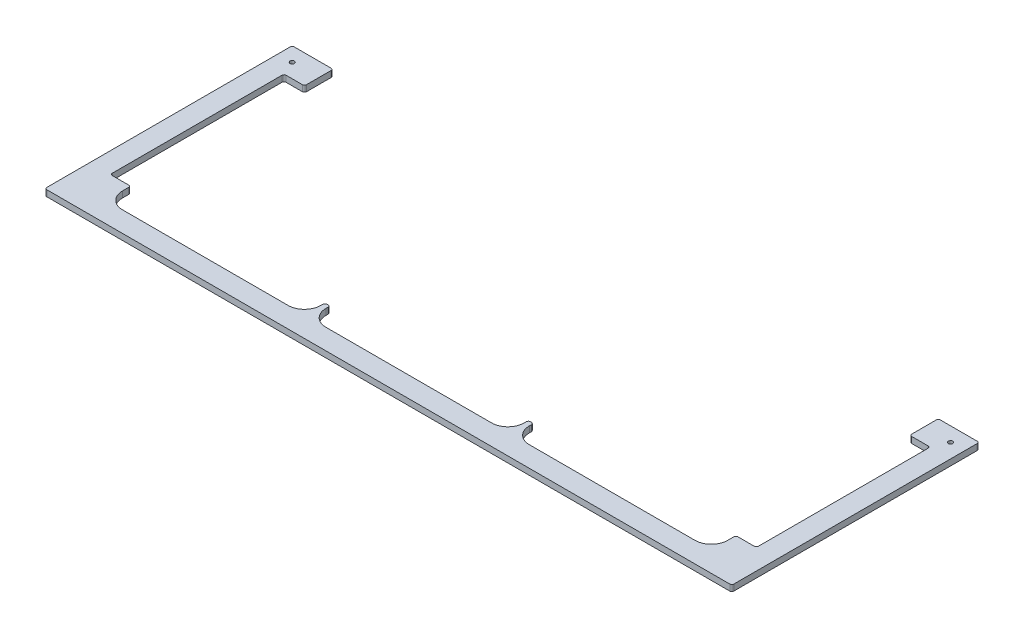
from build123d import *

# Parameters (mm, degrees)
SKETCH1_R           = 3.3734375
BOSS_EXTRUDE1_DEPTH = 9.525


with BuildPart() as part:
    # Sketch1 → Boss-Extrude1 (new body)
    with BuildSketch(Plane(origin=(0, 0, 0), x_dir=(1, 0, 0), z_dir=(0, 1, 0))):
        with BuildLine():
            Line((1006.475, 384.175), (1063.625, 384.175))
            ThreePointArc((1063.625, 384.175), (1065.87006403, 383.24506403), (1066.8, 381))
            Line((1066.8, 381), (1066.8, 3.175))
            ThreePointArc((1066.8, 3.175), (1065.87006403, 0.92993597), (1063.625, 0))
            Line((1063.625, 0), (3.175, 0))
            ThreePointArc((3.175, 0), (0.92993597, 0.92993597), (0, 3.175))
            Line((0, 3.175), (0, 381))
            ThreePointArc((0, 381), (0.92993597, 383.24506403), (3.175, 384.175))
            Line((3.175, 384.175), (60.325, 384.175))
            ThreePointArc((60.325, 384.175), (62.57006403, 383.24506403), (63.5, 381))
            Line((63.5, 381), (63.5, 342.9))
            ThreePointArc((63.5, 342.9), (62.57006403, 340.65493597), (60.325, 339.725))
            Line((60.325, 339.725), (34.925, 339.725))
            ThreePointArc((34.925, 339.725), (32.67993597, 338.79506403), (31.75, 336.55))
            Line((31.75, 336.55), (31.75, 73.025))
            ThreePointArc((31.75, 73.025), (32.67993597, 70.77993597), (34.925, 69.85))
            Line((34.925, 69.85), (60.325, 69.85))
            ThreePointArc((60.325, 69.85), (62.57006403, 68.92006403), (63.5, 66.675))
            Line((63.5, 66.675), (63.5, 57.15))
            ThreePointArc((63.5, 57.15), (70.939487758, 39.189487758), (88.9, 31.75))
            Line((88.9, 31.75), (346.075, 31.75))
            ThreePointArc((346.075, 31.75), (364.035512242, 39.189487758), (371.475, 57.15))
            Line((371.475, 57.15), (371.475, 60.325))
            ThreePointArc((371.475, 60.325), (372.40493597, 62.57006403), (374.65, 63.5))
            Line((374.65, 63.5), (376.2375, 63.5))
            ThreePointArc((376.2375, 63.5), (378.48256403, 62.57006403), (379.4125, 60.325))
            Line((379.4125, 60.325), (379.4125, 57.15))
            ThreePointArc((379.4125, 57.15), (386.851987758, 39.189487758), (404.8125, 31.75))
            Line((404.8125, 31.75), (661.9875, 31.75))
            ThreePointArc((661.9875, 31.75), (679.948012242, 39.189487758), (687.3875, 57.15))
            Line((687.3875, 57.15), (687.3875, 60.325))
            ThreePointArc((687.3875, 60.325), (688.31743597, 62.57006403), (690.5625, 63.5))
            Line((690.5625, 63.5), (692.15, 63.5))
            ThreePointArc((692.15, 63.5), (694.39506403, 62.57006403), (695.325, 60.325))
            Line((695.325, 60.325), (695.325, 57.15))
            ThreePointArc((695.325, 57.15), (702.764487758, 39.189487758), (720.725, 31.75))
            Line((720.725, 31.75), (977.9, 31.75))
            ThreePointArc((977.9, 31.75), (995.860512242, 39.189487758), (1003.3, 57.15))
            Line((1003.3, 57.15), (1003.3, 66.675))
            ThreePointArc((1003.3, 66.675), (1004.22993597, 68.92006403), (1006.475, 69.85))
            Line((1006.475, 69.85), (1031.875, 69.85))
            ThreePointArc((1031.875, 69.85), (1034.12006403, 70.77993597), (1035.05, 73.025))
            Line((1035.05, 73.025), (1035.05, 336.55))
            ThreePointArc((1035.05, 336.55), (1034.12006403, 338.79506403), (1031.875, 339.725))
            Line((1031.875, 339.725), (1006.475, 339.725))
            ThreePointArc((1006.475, 339.725), (1004.22993597, 340.65493597), (1003.3, 342.9))
            Line((1003.3, 342.9), (1003.3, 381))
            ThreePointArc((1003.3, 381), (1004.22993597, 383.24506403), (1006.475, 384.175))
        make_face()
        with Locations(Location((22.225, 361.95, 0), (0, 0, 90))):
            Circle(SKETCH1_R, mode=Mode.SUBTRACT)
        with Locations(Location((1044.575, 361.95, 0), (0, 0, 90))):
            Circle(SKETCH1_R, mode=Mode.SUBTRACT)
    extrude(amount=BOSS_EXTRUDE1_DEPTH)


solid = part.part
